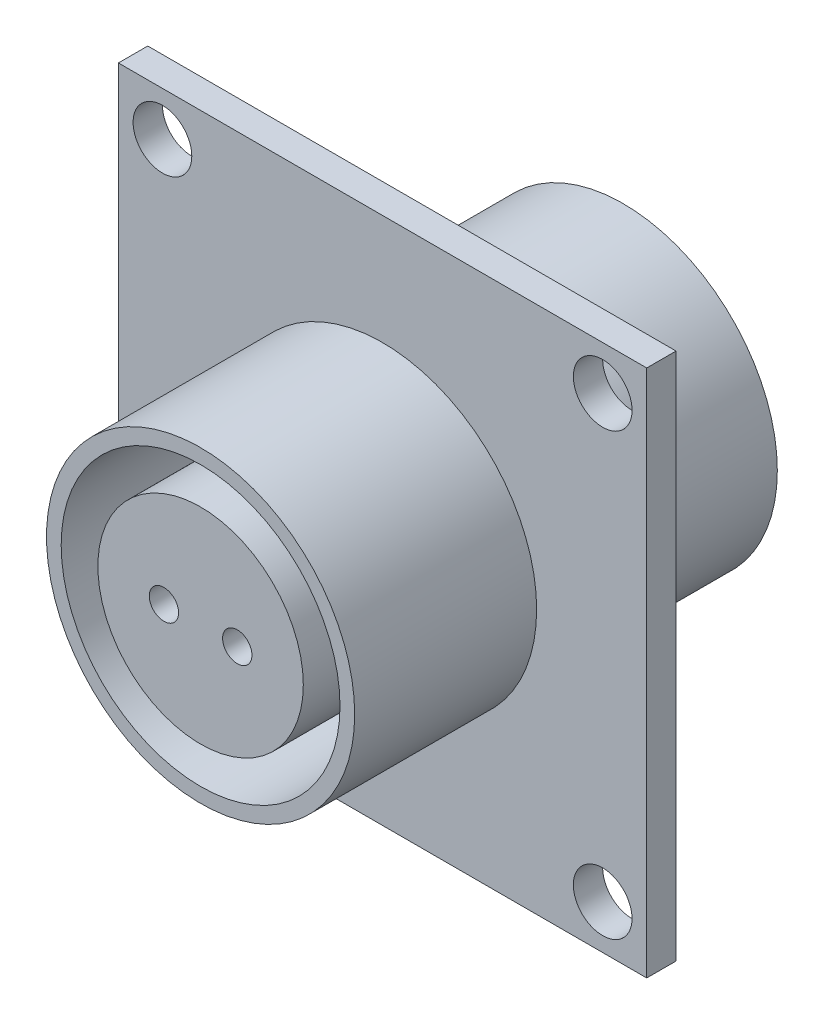
from build123d import *

# Parameters (mm, degrees)
SKETCH_1_W           = 36
SKETCH_1_H           = 36
SKETCH_1_R           = 2
EXTRUDE_1_DEPTH      = 2
EXTRUDE_2_DEPTH      = 12.4
EXTRUDE_2_DEPTH_BACK = 16.4
SKETCH_2_R           = 10.5
SKETCH_3_R           = 9.5
SKETCH_3_R_2         = 7
SKETCH_3_R_3         = 1
CUT_EXTRUDE_1_DEPTH  = 10


with BuildPart() as part:
    # 草图1 → 凸台-拉伸1 (new body)
    with BuildSketch(Plane.XY):
        with Locations((15, -15)):
            Rectangle(SKETCH_1_W, SKETCH_1_H)
        Circle(SKETCH_1_R, mode=Mode.SUBTRACT)
        with Locations((0, -30)):
            Circle(SKETCH_1_R, mode=Mode.SUBTRACT)
        with Locations((30, -30)):
            Circle(SKETCH_1_R, mode=Mode.SUBTRACT)
        with Locations((30, 0)):
            Circle(SKETCH_1_R, mode=Mode.SUBTRACT)
    extrude(amount=EXTRUDE_1_DEPTH)

    # 草图2 → 凸台-拉伸2 (add, two sides: drawn at the far end of the back side and taken through both)
    with BuildSketch(Plane.XY.offset(2).offset(-EXTRUDE_2_DEPTH_BACK)):
        with Locations((15, -15)):
            Circle(SKETCH_2_R)
    extrude(amount=EXTRUDE_2_DEPTH + EXTRUDE_2_DEPTH_BACK)

    # 草图3 → 切除-拉伸1 (cut)
    # profile 1 of 3: a face of its own
    with BuildSketch(Plane.XY.offset(14.4)):
        with Locations((15, -15)):
            Circle(SKETCH_3_R)
        with Locations((15, -15)):
            Circle(SKETCH_3_R_2, mode=Mode.SUBTRACT)
    # profile 2 of 3: a face of its own
    with BuildSketch(Plane.XY.offset(14.4)):
        with Locations((17.5, -15)):
            Circle(SKETCH_3_R_3)
    # profile 3 of 3: a face of its own
    with BuildSketch(Plane.XY.offset(14.4)):
        with Locations((12.5, -15)):
            Circle(SKETCH_3_R_3)
    extrude(amount=-CUT_EXTRUDE_1_DEPTH, mode=Mode.SUBTRACT)


solid = part.part
